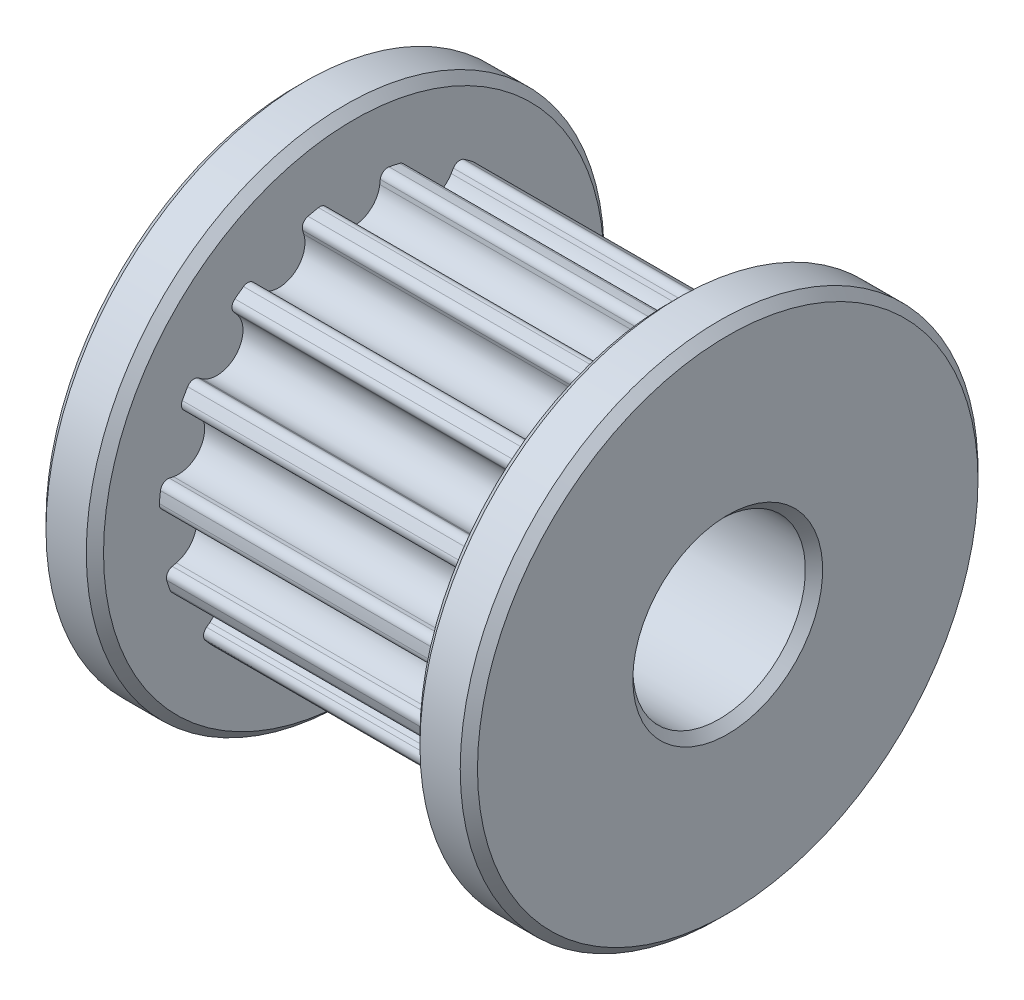
from build123d import *

# Parameters (mm, degrees)
SKETCH_1_W               = 11
SKETCH_1_H               = 3.779
CUT_EXTRUDE_2_REACH      = 16.591
PATTERN_CIRCULAR_3_COUNT = 15
EXTRUDE_START            = 2
SKETCH_7_R               = 9
SKETCH_7_R_2             = 3
EXTRUDE_1_DEPTH          = 2
EXTRUDE_START_2          = -11
SKETCH_7_2_R             = 9
SKETCH_7_2_R_2           = 3
EXTRUDE_2_DEPTH          = 2
CHAMFER_1_SIZE           = 0.3


with BuildPart() as part:
    # 草图1 → 旋转1 (revolve)
    with BuildSketch(Plane.XY, mode=Mode.PRIVATE) as revolve_1_sk:
        with Locations((5.5, 4.8895)):
            Rectangle(SKETCH_1_W, SKETCH_1_H)
    revolve(revolve_1_sk.sketch.rotate(Axis((0, 0, 0), (1, 0, 0)), 90), axis=Axis((0, 0, 0), (1, 0, 0)))

    # 草图6 → 切除-拉伸2 (cut, up to next)
    with BuildSketch(Plane(origin=(0, 0, 0), x_dir=(0, 0, -1), z_dir=(1, 0, 0)), mode=Mode.PRIVATE) as cut_extrude_2_sk1:
        with BuildLine():
            Line((0.921029279, 6.443168288), (0.903216998, 6.298098898))
            ThreePointArc((0.903216998, 6.298098898), (0, 5.499), (-0.903216998, 6.298098898))
            Line((-0.903216998, 6.298098898), (-0.921029279, 6.443168288))
            ThreePointArc((-0.921029279, 6.443168288), (-1.025205225, 6.62105106), (-1.226117469, 6.667194084))
            ThreePointArc((-1.226117469, 6.667194084), (-1.353747907, 6.642454938), (-1.480880455, 6.615272789))
            Line((-1.480880455, 6.615272789), (-1.677528444, 8.216842132))
            ThreePointArc((-1.677528444, 8.216842132), (0, 8.386333901), (1.677528444, 8.216842132))
            Line((1.677528444, 8.216842132), (1.480880455, 6.615272789))
            ThreePointArc((1.480880455, 6.615272789), (1.353747907, 6.642454938), (1.226117469, 6.667194084))
            ThreePointArc((1.226117469, 6.667194084), (1.025205225, 6.62105106), (0.921029279, 6.443168288))
        make_face()
    cut_extrude_2_tool1 = extrude(cut_extrude_2_sk1.sketch, amount=CUT_EXTRUDE_2_REACH, mode=Mode.PRIVATE) & part.part
    cut_extrude_2 = cut_extrude_2_tool1.solids().sort_by_distance((0, 7.172733, 0))[0]
    add(cut_extrude_2, mode=Mode.SUBTRACT)

    # 阵列(圆周)3: 切除-拉伸2 ×15 about axis
    pattern_circular_3_axis = Axis((0, 0, 0), (1, 0, 0))
    for i in range(1, PATTERN_CIRCULAR_3_COUNT):
        add(cut_extrude_2.rotate(pattern_circular_3_axis, i * 360 / PATTERN_CIRCULAR_3_COUNT), mode=Mode.SUBTRACT)

    # 草图7 → 凸台-拉伸1 (add)
    with BuildSketch(Plane.ZY.offset(EXTRUDE_START)):
        Circle(SKETCH_7_R)
        Circle(SKETCH_7_R_2, mode=Mode.SUBTRACT)
    extrude(amount=-EXTRUDE_1_DEPTH)

    # 草图7<2> → 凸台-拉伸2 (add)
    with BuildSketch(Plane.ZY.offset(EXTRUDE_START_2)):
        Circle(SKETCH_7_2_R)
        Circle(SKETCH_7_2_R_2, mode=Mode.SUBTRACT)
    extrude(amount=-EXTRUDE_2_DEPTH)

    # 倒角1
    chamfer_1_edges = [part.edges().sort_by_distance(p)[0] for p in [
        (-2, 0, -9),
        (0, 0, -9),
        (-2, 0, -3),
        (13, 0, -9),
        (13, 0, -3),
        (11, 0, -9),
    ]]
    chamfer(chamfer_1_edges, length=CHAMFER_1_SIZE)


solid = part.part
